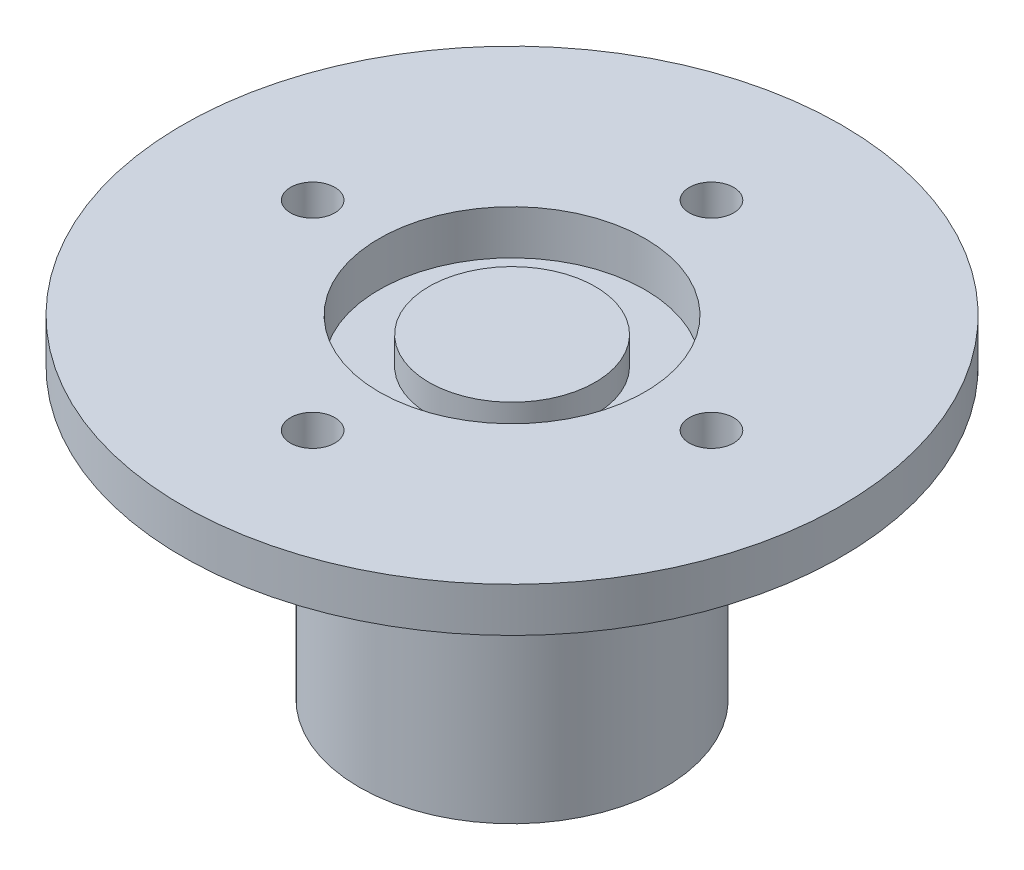
from build123d import *

# Parameters (mm, degrees)
SKETCH1_R           = 7.5
BOSS_EXTRUDE1_DEPTH = 2.5
SKETCH2_R           = 29.75
SKETCH2_R_2         = 12
BOSS_EXTRUDE2_DEPTH = 4
SKETCH3_R           = 13.8
BOSS_EXTRUDE3_DEPTH = 26
SKETCH4_R           = 5
CUT_EXTRUDE1_DEPTH  = 25.5
SKETCH5_R           = 2
CUT_EXTRUDE2_DEPTH  = 52.673252268


with BuildPart() as part:
    # Sketch1 → Boss-Extrude1 (new body)
    with BuildSketch(Plane(origin=(0, 0, 0), x_dir=(1, 0, 0), z_dir=(0, 1, 0))):
        with Locations(Location((0, 0, 0), (0, 0, 270))):
            Circle(SKETCH1_R)
    extrude(amount=BOSS_EXTRUDE1_DEPTH)



with BuildPart() as body_2:
    # Sketch2 → Boss-Extrude2 (new body)
    with BuildSketch(Plane.XZ):
        with Locations(Location((0, 0, 0), (0, 0, 270))):
            Circle(SKETCH2_R)
        with Locations(Location((0, 0, 0), (0, 0, 270))):
            Circle(SKETCH2_R_2, mode=Mode.SUBTRACT)
    extrude(amount=-BOSS_EXTRUDE2_DEPTH)


with BuildPart() as part_1:
    add(part.part)

    add(body_2.part)  # Boss-Extrude3 merges body 2
    # Sketch3 → Boss-Extrude3 (add)
    with BuildSketch(Plane.XZ):
        with Locations(Location((0, 0, 0), (0, 0, 90))):
            Circle(SKETCH3_R)
    extrude(amount=BOSS_EXTRUDE3_DEPTH)

    # Sketch4 → Cut-Extrude1 (cut)
    with BuildSketch(Plane.XZ.offset(26)):
        with Locations(Location((0, 0, 0), (0, 0, 270))):
            Circle(SKETCH4_R)
    extrude(amount=-CUT_EXTRUDE1_DEPTH, mode=Mode.SUBTRACT)

    # Sketch5 → Cut-Extrude2 (cut, through all)
    with BuildSketch(Plane(origin=(0, 4, 0), x_dir=(1, 0, 0), z_dir=(0, 1, 0))):
        with Locations(Location((0, 18, 0), (0, 0, 270))):
            Circle(SKETCH5_R)
        with Locations(Location((18, 0, 0), (0, 0, 270))):
            Circle(SKETCH5_R)
        with Locations(Location((0, -18, 0), (0, 0, 270))):
            Circle(SKETCH5_R)
        with Locations(Location((-18, 0, 0), (0, 0, 270))):
            Circle(SKETCH5_R)
    extrude(amount=-CUT_EXTRUDE2_DEPTH, mode=Mode.SUBTRACT)


solid = part_1.part
